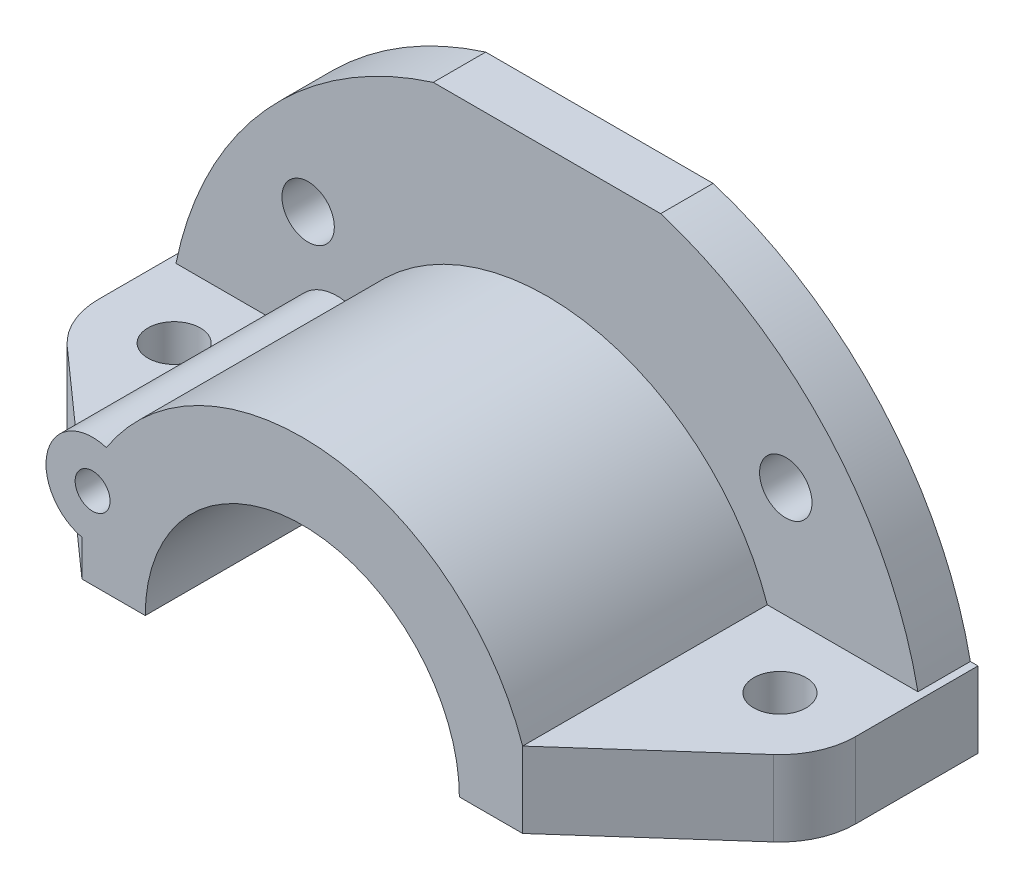
from build123d import *

# Parameters (mm, degrees)
BOSS_EXTRUDE1_DEPTH       = 51
BOSS_EXTRUDE2_DEPTH       = 51
SKETCH1_4_R               = 4.5
BOSS_EXTRUDE3_DEPTH       = 9
CUT_EXTRUDE1_REACH        = 98.057
SKETCH2_R                 = 4.5
BOSS_EXTRUDE4_START       = -42
SKETCH3_R                 = 8
BOSS_EXTRUDE4_DEPTH       = 42
F_6_0MM_DOWEL_HOLE1_D     = 6
F_6_0MM_DOWEL_HOLE1_DEPTH = 13


with BuildPart() as part:
    # Sketch1 → Boss-Extrude1 (new body)
    with BuildSketch(Plane.XY):
        with BuildLine():
            ThreePointArc((40, 0), (39.453405592, 6.590052141), (37.828560639, 13))
            ThreePointArc((37.828560639, 13), (0, 40), (-37.828560639, 13))
            ThreePointArc((-37.828560639, 13), (-39.453405592, 6.590052141), (-40, 0))
            Line((-40, 0), (-26.965, 0))
            ThreePointArc((-26.965, 0), (0, 26.965), (26.965, 0))
            Line((26.965, 0), (40, 0))
        make_face()
    extrude(amount=BOSS_EXTRUDE1_DEPTH)

    # Sketch1<3> → Boss-Extrude2 (add)
    with BuildSketch(Plane.XY):
        with BuildLine():
            Line((63.686733312, 13), (37.828560639, 13))
            ThreePointArc((37.828560639, 13), (39.453405592, 6.590052141), (40, 0))
            Line((40, 0), (65, 0))
            Line((65, 0), (65, 13))
            Line((65, 13), (63.686733312, 13))
        make_face()
        with BuildLine():
            ThreePointArc((-40, 0), (-39.453405592, 6.590052141), (-37.828560639, 13))
            Line((-37.828560639, 13), (-63.686733312, 13))
            Line((-63.686733312, 13), (-65, 13))
            Line((-65, 13), (-65, 0))
            Line((-65, 0), (-40, 0))
        make_face()
    extrude(amount=BOSS_EXTRUDE2_DEPTH)

    # Sketch1<4> → Boss-Extrude3 (add)
    with BuildSketch(Plane.XY):
        with BuildLine():
            ThreePointArc((-37.828560639, 13), (0, 40), (37.828560639, 13))
            Line((37.828560639, 13), (63.686733312, 13))
            ThreePointArc((63.686733312, 13), (48.281028578, 43.519447141), (19.519221296, 62))
            Line((19.519221296, 62), (-19.519221296, 62))
            ThreePointArc((-19.519221296, 62), (-48.281028578, 43.519447141), (-63.686733312, 13))
            Line((-63.686733312, 13), (-37.828560639, 13))
        make_face()
        with Locations((-41, 32)):
            Circle(SKETCH1_4_R, mode=Mode.SUBTRACT)
        with Locations((41, 32)):
            Circle(SKETCH1_4_R, mode=Mode.SUBTRACT)
    extrude(amount=BOSS_EXTRUDE3_DEPTH)

    # Sketch2 → Cut-Extrude1 (cut, up to next)
    with BuildSketch(Plane(origin=(0, 13, 0), x_dir=(1, 0, 0), z_dir=(0, 1, 0)), mode=Mode.PRIVATE) as cut_extrude1_sk1:
        with Locations(Location((52, -21, 0), (0, 0, 180))):
            Circle(SKETCH2_R)
    cut_extrude1_tool1 = extrude(cut_extrude1_sk1.sketch, amount=-CUT_EXTRUDE1_REACH, mode=Mode.PRIVATE) & part.part
    # Sketch2 → Cut-Extrude1 (cut, up to next)
    with BuildSketch(Plane(origin=(0, 13, 0), x_dir=(1, 0, 0), z_dir=(0, 1, 0)), mode=Mode.PRIVATE) as cut_extrude1_sk2:
        with Locations(Location((-52, -21, 0), (0, 0, 180))):
            Circle(SKETCH2_R)
    cut_extrude1_tool2 = extrude(cut_extrude1_sk2.sketch, amount=-CUT_EXTRUDE1_REACH, mode=Mode.PRIVATE) & part.part
    # Sketch2 → Cut-Extrude1 (cut, up to next)
    with BuildSketch(Plane(origin=(0, 13, 0), x_dir=(1, 0, 0), z_dir=(0, 1, 0)), mode=Mode.PRIVATE) as cut_extrude1_sk3:
        with BuildLine():
            Line((65, -51), (65, -21))
            ThreePointArc((65, -21), (63.859756378, -26.324112946), (60.639049437, -30.714258841))
            Line((60.639049437, -30.714258841), (37.828560639, -51))
            Line((37.828560639, -51), (65, -51))
        make_face()
    cut_extrude1_tool3 = extrude(cut_extrude1_sk3.sketch, amount=-CUT_EXTRUDE1_REACH, mode=Mode.PRIVATE) & part.part
    # Sketch2 → Cut-Extrude1 (cut, up to next)
    with BuildSketch(Plane(origin=(0, 13, 0), x_dir=(1, 0, 0), z_dir=(0, 1, 0)), mode=Mode.PRIVATE) as cut_extrude1_sk4:
        with BuildLine():
            Line((-65, -51), (-37.828560639, -51))
            Line((-37.828560639, -51), (-60.639049437, -30.714258841))
            ThreePointArc((-60.639049437, -30.714258841), (-63.859756378, -26.324112946), (-65, -21))
            Line((-65, -21), (-65, -51))
        make_face()
    cut_extrude1_tool4 = extrude(cut_extrude1_sk4.sketch, amount=-CUT_EXTRUDE1_REACH, mode=Mode.PRIVATE) & part.part
    add(cut_extrude1_tool1.solids().sort_by_distance((52, 13, 21))[0], mode=Mode.SUBTRACT)
    add(cut_extrude1_tool2.solids().sort_by_distance((-52, 13, 21))[0], mode=Mode.SUBTRACT)
    add(cut_extrude1_tool3.solids().sort_by_distance((56.054542, 13, 42.719243))[0], mode=Mode.SUBTRACT)
    add(cut_extrude1_tool4.solids().sort_by_distance((-56.054542, 13, 42.719243))[0], mode=Mode.SUBTRACT)

    # Sketch3 → Boss-Extrude4 (add)
    with BuildSketch(Plane.XY.offset(51).offset(BOSS_EXTRUDE4_START)):
        with Locations((-36, 14)):
            Circle(SKETCH3_R)
    extrude(amount=BOSS_EXTRUDE4_DEPTH)

    # Ø6.0mm Dowel Hole1
    with Locations(Plane.XY.offset(51)):
        with Locations((-36, 14)):
            Hole(F_6_0MM_DOWEL_HOLE1_D / 2, depth=F_6_0MM_DOWEL_HOLE1_DEPTH)


solid = part.part
